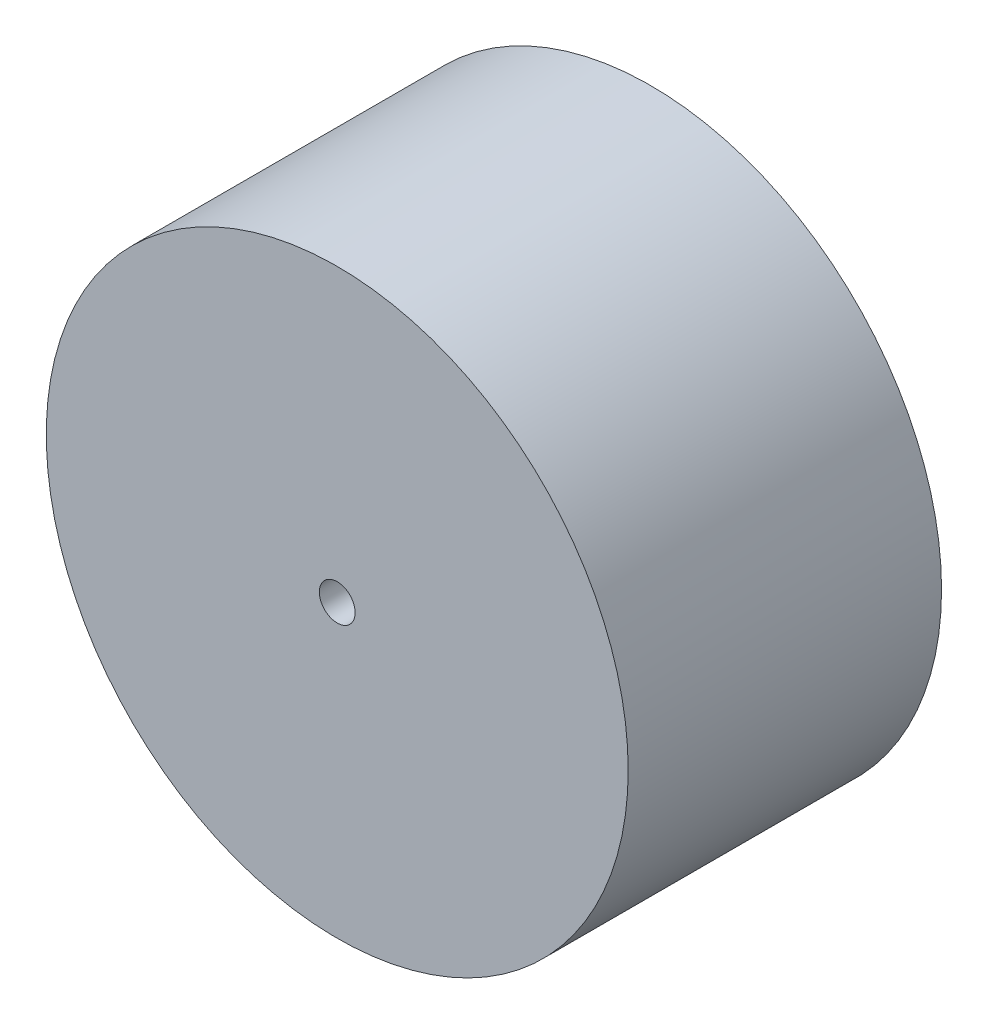
from build123d import *

# Parameters (mm, degrees)
SKETCH1_R           = 32.5
SKETCH1_R_2         = 2
BOSS_EXTRUDE1_DEPTH = 35


with BuildPart() as part:
    # Sketch1 → Boss-Extrude1 (new body)
    with BuildSketch(Plane.XY):
        Circle(SKETCH1_R)
        Circle(SKETCH1_R_2, mode=Mode.SUBTRACT)
    extrude(amount=BOSS_EXTRUDE1_DEPTH)


solid = part.part
